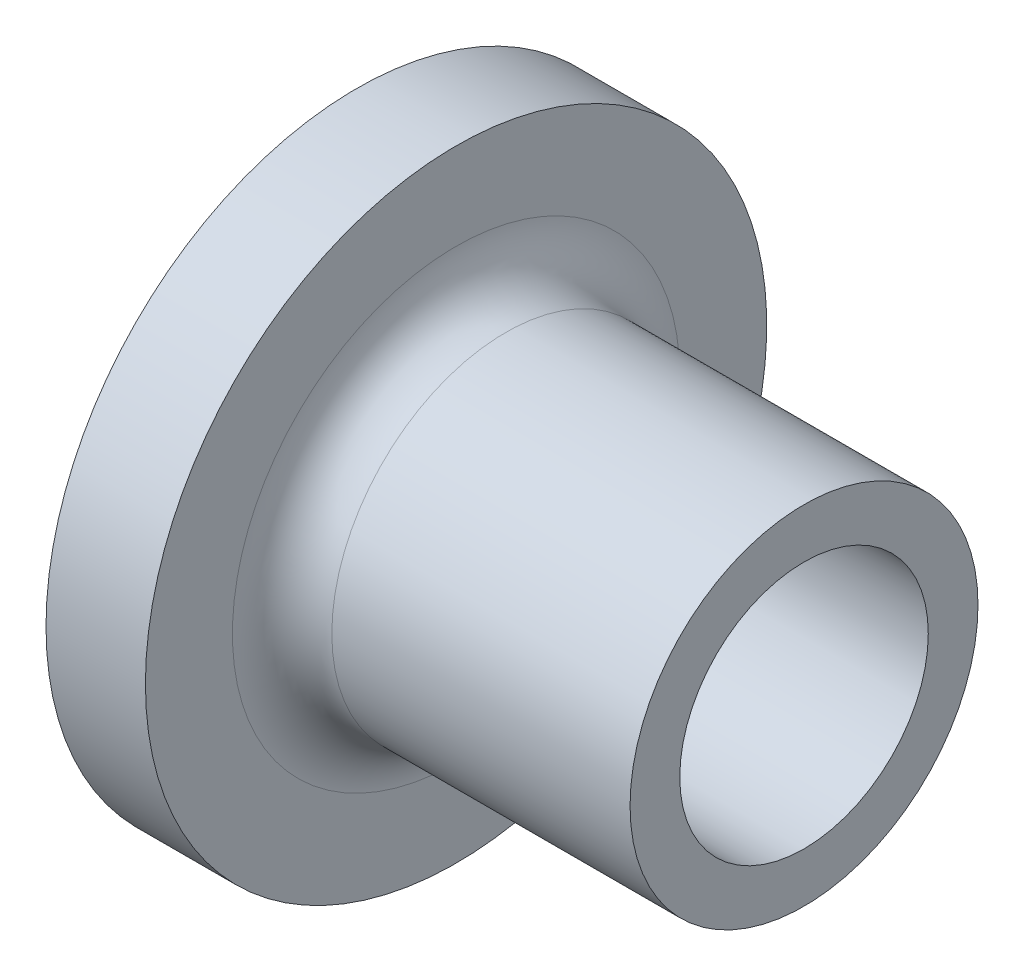
from build123d import *

# Parameters (mm, degrees)
SKETCH1_W = 7
SKETCH1_H = 1
FILLET1_R = 1


with BuildPart() as part:
    # Sketch1 → Revolve1 (revolve)
    with BuildSketch(Plane.XY, mode=Mode.PRIVATE) as revolve1_sk:
        Polygon((-3.5, 2.5), (-3.5, 3.5), (-3.5, 6.25), (-5.5, 6.25), (-5.5, 2.5), align=None)
        with Locations((0, 3)):
            Rectangle(SKETCH1_W, SKETCH1_H)
    revolve(revolve1_sk.sketch.rotate(Axis((0, 0, 0), (1, 0, 0)), 90), axis=Axis((0, 0, 0), (1, 0, 0)))

    # Fillet1
    fillet1_edges = [part.edges().sort_by_distance(p)[0] for p in [
        (-3.5, 0, -3.5),
    ]]
    fillet(fillet1_edges, radius=FILLET1_R)


solid = part.part
